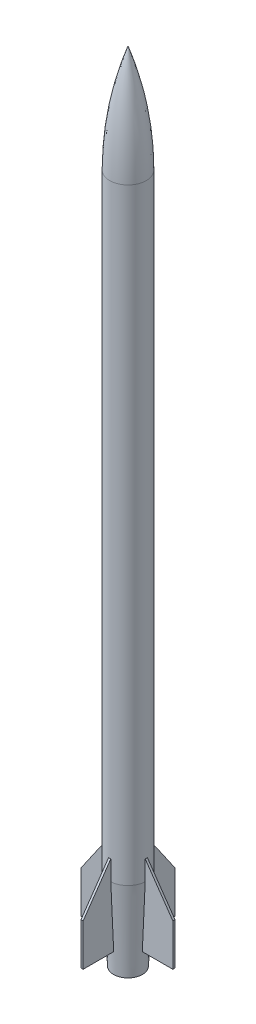
from build123d import *

# Parameters (mm, degrees)
BOSS_EXTRUDE1_DEPTH = 5
CIRPATTERN1_COUNT   = 4


with BuildPart() as part:
    # Sketch2 → Revolve1 (revolve)
    with BuildSketch(Plane.XY):
        with BuildLine():
            Line((0, 0), (0, 3700))
            add(Edge.make_bspline(
                [(0, 3700), (84.865215283, 3457.516619443), (85, 3201.228293863)],
                knots=[0, 0, 0, 1, 1, 1], degree=2))
            Line((85, 3201.228293863), (85, 384.250664913))
            Line((85, 384.250664913), (67.177442708, 0))
            Line((67.177442708, 0), (0, 0))
        make_face()
    revolve(axis=Axis((0, 0, 0), (0, 1, 0)))

    # Sketch3 → Boss-Extrude1 (add, symmetric)
    with BuildSketch(Plane(origin=(0, 0, 0), x_dir=(0, 0, -1), z_dir=(1, 0, 0))):
        Polygon((45.900059678, 532.679877614), (45.900059678, 96.566896632), (213.375004626, 96.566896632), (213.375004626, 291.110499158), align=None)
    boss_extrude1 = extrude(amount=BOSS_EXTRUDE1_DEPTH, both=True)

    # CirPattern1: Boss-Extrude1 ×4 about axis
    cirpattern1_axis = Axis((0, 3700, 0), (0, -1, 0))
    for i in range(1, CIRPATTERN1_COUNT):
        add(boss_extrude1.rotate(cirpattern1_axis, i * 360 / CIRPATTERN1_COUNT))


solid = part.part
